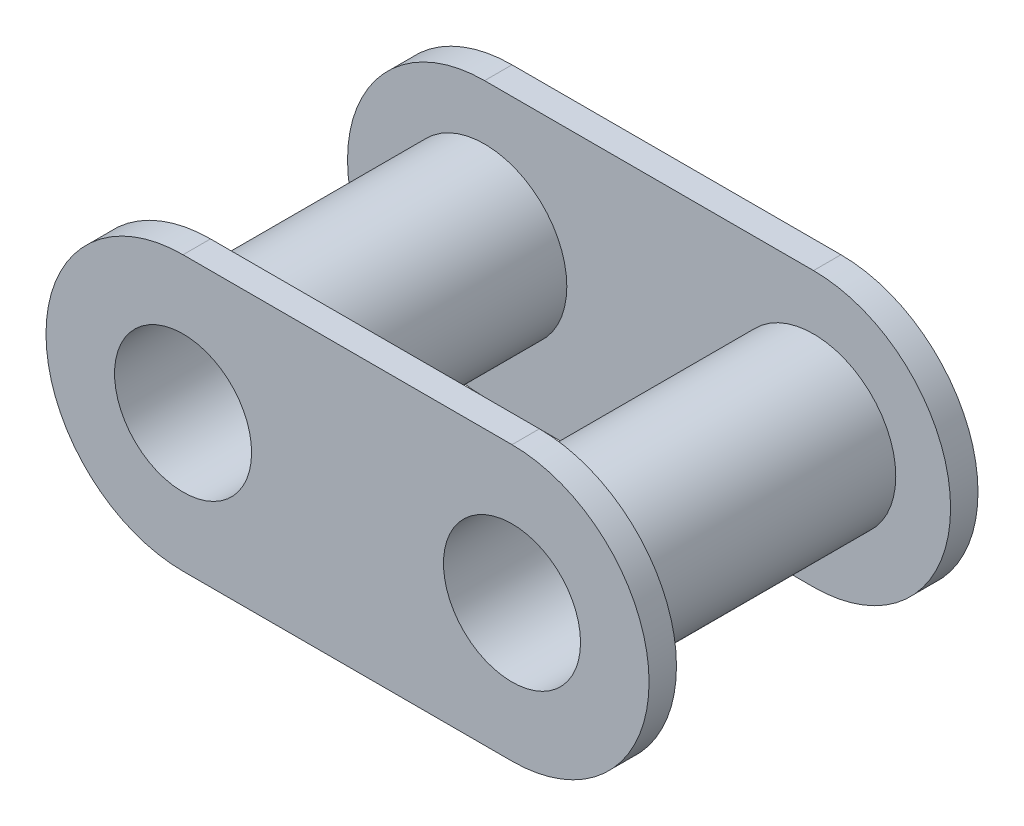
from build123d import *

# Parameters (mm, degrees)
SKETCH1_R           = 1.25
BOSS_EXTRUDE1_DEPTH = 0.5
SKETCH2_R           = 1.5
SKETCH2_R_2         = 1.25
EXTRUDE_THIN1_DEPTH = 2.5


with BuildPart() as part:
    # Sketch1 → Boss-Extrude1 (new body)
    with BuildSketch(Plane.XY):
        with BuildLine():
            Line((-3, 2.5), (3, 2.5))
            ThreePointArc((3, 2.5), (5.5, 0), (3, -2.5))
            Line((3, -2.5), (-3, -2.5))
            ThreePointArc((-3, -2.5), (-5.5, 0), (-3, 2.5))
        make_face()
        with Locations((-3, 0)):
            Circle(SKETCH1_R, mode=Mode.SUBTRACT)
        with Locations((3, 0)):
            Circle(SKETCH1_R, mode=Mode.SUBTRACT)
    boss_extrude1 = extrude(amount=BOSS_EXTRUDE1_DEPTH)

    # Sketch2 → Extrude-Thin1 (add)
    # profile 1 of 2: a face of its own
    with BuildSketch(Plane.XY.offset(0.5)):
        with Locations((-3, 0)):
            Circle(SKETCH2_R)
        with Locations((-3, 0)):
            Circle(SKETCH2_R_2, mode=Mode.SUBTRACT)
    # profile 2 of 2: a face of its own
    with BuildSketch(Plane.XY.offset(0.5)):
        with Locations((3, 0)):
            Circle(SKETCH2_R)
        with Locations((3, 0)):
            Circle(SKETCH2_R_2, mode=Mode.SUBTRACT)
    extrude_thin1 = extrude(amount=EXTRUDE_THIN1_DEPTH)

    # Mirror1: Boss-Extrude1, Extrude-Thin1 across plane
    add(boss_extrude1.mirror(Plane.XY.offset(3)))
    add(extrude_thin1.mirror(Plane.XY.offset(3)))


solid = part.part
